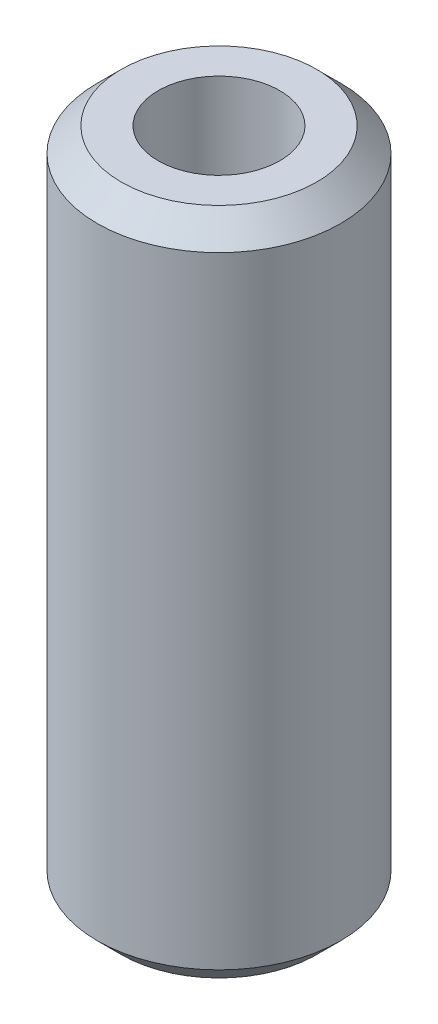
from build123d import *

# Parameters (mm, degrees)
SKETCH1_R           = 12.7
SKETCH1_R_2         = 6.35
BOSS_EXTRUDE1_DEPTH = 34.925
CHAMFER1_SIZE       = 2.5


with BuildPart() as part:
    # Sketch1 → Boss-Extrude1 (new, symmetric)
    with BuildSketch(Plane(origin=(0, 0, 0), x_dir=(1, 0, 0), z_dir=(0, 1, 0))):
        with Locations(Location((0, 0, 0), (0, 0, 270))):
            Circle(SKETCH1_R)
        with Locations(Location((0, 0, 0), (0, 0, 270))):
            Circle(SKETCH1_R_2, mode=Mode.SUBTRACT)
    extrude(amount=BOSS_EXTRUDE1_DEPTH, both=True)

    # Chamfer1
    chamfer1_edges = [part.edges().sort_by_distance(p)[0] for p in [
        (0, -34.925, -12.7),
        (0, 34.925, -12.7),
    ]]
    chamfer(chamfer1_edges, length=CHAMFER1_SIZE)


solid = part.part
